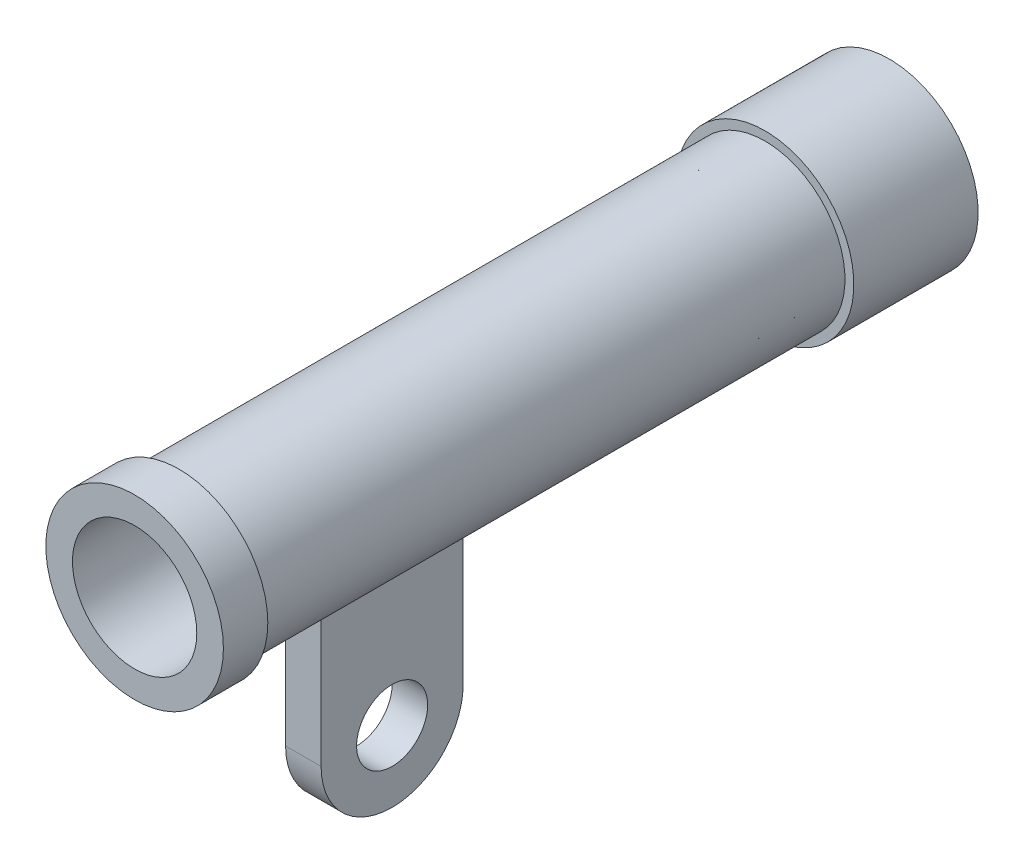
from build123d import *

# Parameters (mm, degrees)
IZIM1_R                     = 45
Y_KSEKLIK_EKSTR_ZYON1_DEPTH = 400
IZIM2_R                     = 35
KES_EKSTR_ZYON1_DEPTH       = 350
IZIM4_R                     = 50
Y_KSEKLIK_EKSTR_ZYON2_DEPTH = 70
IZIM6_R                     = 50
IZIM6_R_2                   = 35
Y_KSEKLIK_EKSTR_ZYON4_DEPTH = 25
IZIM5_R                     = 20
Y_KSEKLIK_EKSTR_ZYON5_DEPTH = 10


with BuildPart() as part:
    # Çizim1 → Yükseklik-Ekstrüzyon1 (new body)
    with BuildSketch(Plane.XY):
        Circle(IZIM1_R)
    extrude(amount=Y_KSEKLIK_EKSTR_ZYON1_DEPTH)

    # Çizim2 → Kes-Ekstrüzyon1 (cut)
    with BuildSketch(Plane.XY.offset(400)):
        Circle(IZIM2_R)
    extrude(amount=-KES_EKSTR_ZYON1_DEPTH, mode=Mode.SUBTRACT)

    # Çizim4 → Yükseklik-Ekstrüzyon2 (add)
    with BuildSketch(Plane(origin=(0, 0, 0), x_dir=(-1, 0, 0), z_dir=(0, 0, -1))):
        Circle(IZIM4_R)
    extrude(amount=-Y_KSEKLIK_EKSTR_ZYON2_DEPTH)

    # Çizim6 → Yükseklik-Ekstrüzyon4 (add)
    with BuildSketch(Plane.XY.offset(400)):
        with Locations(Location((0, 0, 0), (0, 0, 180))):
            Circle(IZIM6_R)
        Circle(IZIM6_R_2, mode=Mode.SUBTRACT)
    extrude(amount=Y_KSEKLIK_EKSTR_ZYON4_DEPTH)


with BuildPart() as body_2:
    # Çizim5 → Yükseklik-Ekstrüzyon5 (new, symmetric)
    with BuildSketch(Plane(origin=(0, 0, 0), x_dir=(0, 0, -1), z_dir=(1, 0, 0))):
        with BuildLine():
            Line((-330, -45), (-330, -125))
            ThreePointArc((-330, -125), (-290, -165), (-250, -125))
            Line((-250, -125), (-250, -45))
            Line((-250, -45), (-330, -45))
        make_face()
        with Locations((-290, -125)):
            Circle(IZIM5_R, mode=Mode.SUBTRACT)
    extrude(amount=Y_KSEKLIK_EKSTR_ZYON5_DEPTH, both=True)


solid = Compound([part.part, body_2.part])
